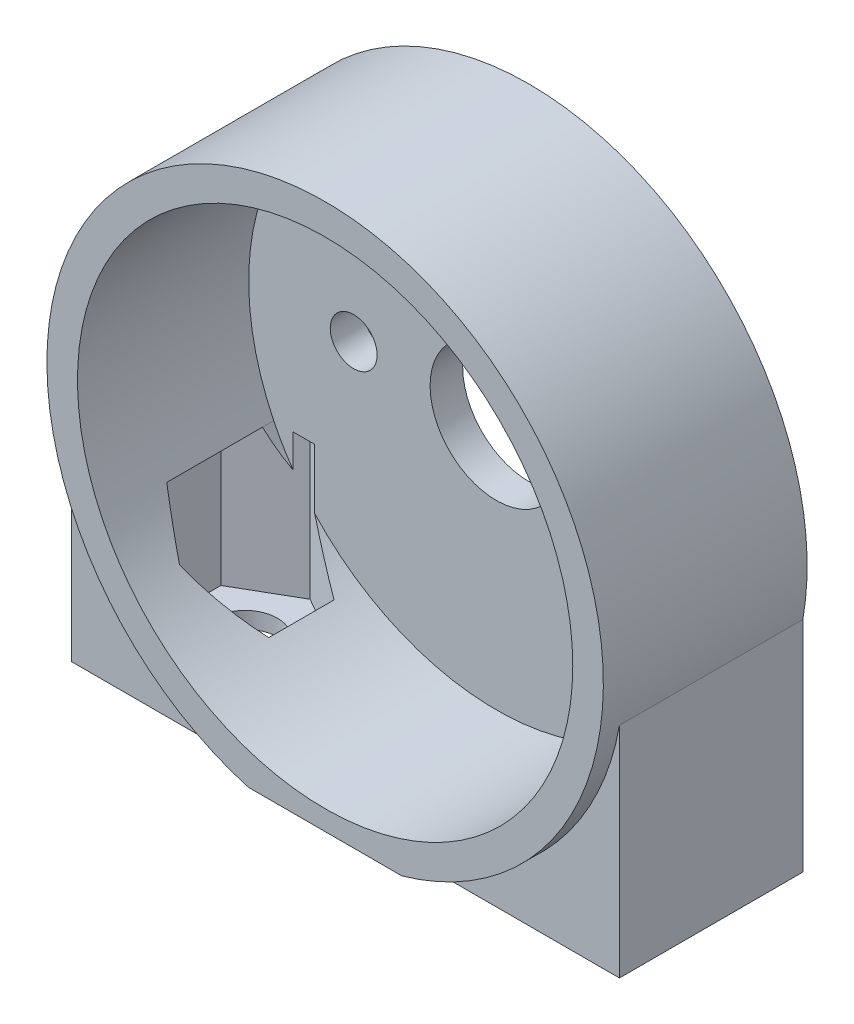
from build123d import *

# Parameters (mm, degrees)
SKETCH1_R           = 13.65
SKETCH1_R_2         = 12.15
BOSS_EXTRUDE1_DEPTH = 10
BOSS_EXTRUDE3_DEPTH = 9
SKETCH5_R           = 1.6
CUT_EXTRUDE1_DEPTH  = 7
SKETCH6_W           = 26.88
SKETCH6_H           = 0.53
CUT_EXTRUDE2_DEPTH  = 22.740400289
SKETCH7_R           = 12.15
SKETCH7_R_2         = 1.15
SKETCH7_R_3         = 3.25
BOSS_EXTRUDE4_DEPTH = 1.6
CUT_EXTRUDE4_START  = -0.8
CUT_EXTRUDE4_DEPTH  = 7


with BuildPart() as part:
    # Sketch1 → Boss-Extrude1 (new body)
    with BuildSketch(Plane.XY):
        Circle(SKETCH1_R)
        Circle(SKETCH1_R_2, mode=Mode.SUBTRACT)
    extrude(amount=BOSS_EXTRUDE1_DEPTH)

    # Sketch3 → Boss-Extrude3 (add)
    with BuildSketch(Plane(origin=(0, 0, 0), x_dir=(-1, 0, 0), z_dir=(0, 0, -1))):
        with BuildLine():
            Line((-13.44, -13.65), (0, -13.65))
            ThreePointArc((0, -13.65), (-8.768275727, -10.461349854), (-13.44, -2.385141505))
            Line((-13.44, -2.385141505), (-13.44, -13.65))
        make_face()
        with BuildLine():
            ThreePointArc((13.44, -2.385141505), (8.768275727, -10.461349854), (0, -13.65))
            Line((0, -13.65), (13.44, -13.65))
            Line((13.44, -13.65), (13.44, -2.385141505))
        make_face()
    extrude(amount=-BOSS_EXTRUDE3_DEPTH)

    # Sketch5 → Cut-Extrude1 (cut)
    with BuildSketch(Plane.XZ.offset(13.65)):
        with Locations((-9.44, 4.5)):
            Circle(SKETCH5_R)
        with Locations(Location((9.44, 4.5, 0), (0, 0, 62.911777465))):
            Circle(SKETCH5_R)
    extrude(amount=-CUT_EXTRUDE1_DEPTH, mode=Mode.SUBTRACT)

    # Sketch6 → Cut-Extrude2 (cut, through all)
    with BuildSketch(Plane(origin=(0, 0, 0), x_dir=(-1, 0, 0), z_dir=(0, 0, -1))):
        with Locations((0, -13.385)):
            Rectangle(SKETCH6_W, SKETCH6_H)
    extrude(amount=-CUT_EXTRUDE2_DEPTH, mode=Mode.SUBTRACT)

    # Sketch7 → Boss-Extrude4 (add)
    with BuildSketch(Plane(origin=(0, 0, 0), x_dir=(-1, 0, 0), z_dir=(0, 0, -1))):
        Circle(SKETCH7_R)
        with Locations((-7, 0)):
            Circle(SKETCH7_R_2, mode=Mode.SUBTRACT)
        with Locations((7, 0)):
            Circle(SKETCH7_R_2, mode=Mode.SUBTRACT)
        Circle(SKETCH7_R_3, mode=Mode.SUBTRACT)
    extrude(amount=-BOSS_EXTRUDE4_DEPTH)

    # Sketch8 → Cut-Extrude4 (cut)
    with BuildSketch(Plane.XZ.offset(13.12).offset(CUT_EXTRUDE4_START)):
        Polygon((-12.215, 2.897853003), (-9.44, 1.295706006), (-6.665, 2.897853003), (-6.665, 6.102146997), (-9.44, 7.704293994), (-12.215, 6.102146997), align=None)
        Polygon((12.215, 6.102146997), (12.215, 2.897853003), (9.44, 1.295706006), (6.665, 2.897853003), (6.665, 6.102146997), (9.44, 7.704293994), align=None)
    extrude(amount=-CUT_EXTRUDE4_DEPTH, mode=Mode.SUBTRACT)


solid = part.part
